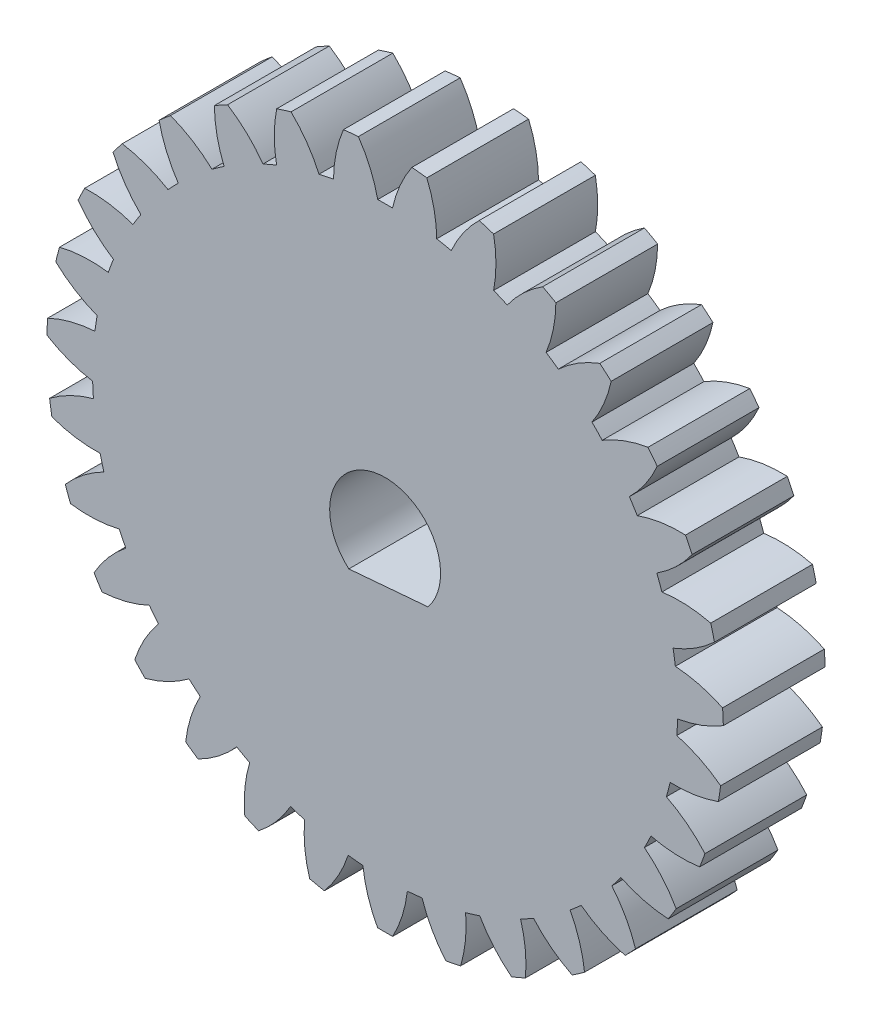
from build123d import *

# Parameters (mm, degrees)
BOSS_EXTRUDE1_DEPTH = 5


with BuildPart() as part:
    # Model → Boss-Extrude1 (new body)
    with BuildSketch(Plane.XY):
        with BuildLine():
            ThreePointArc((14.369367897, -0.364886625), (15.533878417, -0.05414421), (16.618302644, 0.4718498))
            ThreePointArc((16.618302644, 0.4718498), (16.603661932, 0.842042432), (16.58077576, 1.211816902))
            ThreePointArc((16.58077576, 1.211816902), (15.448701432, 1.625402827), (14.25872835, 1.816739348))
            ThreePointArc((14.25872835, 1.816739348), (14.208243694, 2.176622874), (14.148677229, 2.535115118))
            ThreePointArc((14.148677229, 2.535115118), (15.226798163, 3.073910862), (16.183142346, 3.807430735))
            ThreePointArc((16.183142346, 3.807430735), (16.094282101, 4.167098349), (15.997429357, 4.524696561))
            ThreePointArc((15.997429357, 4.524696561), (14.805274422, 4.701931471), (13.6011444, 4.649811502))
            ThreePointArc((13.6011444, 4.649811502), (13.479249148, 4.992165704), (13.348738054, 5.33132895))
            ThreePointArc((13.348738054, 5.33132895), (14.296331003, 6.076119662), (15.085442299, 6.987135009))
            ThreePointArc((15.085442299, 6.987135009), (14.92600047, 7.32155277), (14.759146317, 7.652334612))
            ThreePointArc((14.759146317, 7.652334612), (13.555717739, 7.585962488), (12.386728002, 7.292519826))
            ThreePointArc((12.386728002, 7.292519826), (12.198412557, 7.603328684), (12.002299974, 7.909277549))
            ThreePointArc((12.002299974, 7.909277549), (12.780570371, 8.829571409), (13.370142472, 9.880785155))
            ThreePointArc((13.370142472, 9.880785155), (13.146646627, 10.17626196), (12.916622092, 10.466685184))
            ThreePointArc((12.916622092, 10.466685184), (11.751188378, 10.15942331), (10.665197503, 9.636671533))
            ThreePointArc((10.665197503, 9.636671533), (10.418171524, 9.903210495), (10.164486323, 10.163419395))
            ThreePointArc((10.164486323, 10.163419395), (10.741571688, 11.221539465), (11.107467442, 12.369914795))
            ThreePointArc((11.107467442, 12.369914795), (10.829067525, 12.61435379), (10.545289841, 12.852528435))
            ThreePointArc((10.545289841, 12.852528435), (9.465563984, 12.316956148), (8.507032565, 11.586296774))
            ThreePointArc((8.507032565, 11.586296774), (8.211409324, 11.797653704), (7.910537407, 12.001469657))
            ThreePointArc((7.910537407, 12.001469657), (8.262811797, 13.154096377), (8.390051389, 14.35261867))
            ThreePointArc((8.390051389, 14.35261867), (8.068145127, 14.536012493), (7.742232185, 14.712187662))
            ThreePointArc((7.742232185, 14.712187662), (6.792418289, 13.970231354), (6.000588715, 13.061577664))
            ThreePointArc((6.000588715, 13.061577664), (5.668471061, 13.209099584), (5.332730161, 13.348178341))
            ThreePointArc((5.332730161, 13.348178341), (5.44577142, 14.548123038), (5.329145646, 15.747724651))
            ThreePointArc((5.329145646, 15.747724651), (4.97691192, 15.862565138), (4.622206634, 15.969528197))
            ThreePointArc((4.622206634, 15.969528197), (3.84119019, 15.051563646), (3.248480058, 14.00211603))
            ThreePointArc((3.248480058, 14.00211603), (2.893464928, 14.079763376), (2.536600316, 14.148411036))
            ThreePointArc((2.536600316, 14.148411036), (2.405780521, 15.346547832), (2.050064055, 16.498116934))
            ThreePointArc((2.050064055, 16.498116934), (1.681923353, 16.539702501), (1.3129474, 16.573074372))
            ThreePointArc((1.3129474, 16.573074372), (0.732703314, 15.516683155), (0.363378245, 14.36940612))
            ThreePointArc((0.363378245, 14.36940612), (0, 14.374), (-0.363378245, 14.36940612))
            ThreePointArc((-0.363378245, 14.36940612), (-0.732703314, 15.516683155), (-1.3129474, 16.573074372))
            ThreePointArc((-1.3129474, 16.573074372), (-1.681923353, 16.539702501), (-2.050064055, 16.498116934))
            ThreePointArc((-2.050064055, 16.498116934), (-2.405780521, 15.346547832), (-2.536600315, 14.148411036))
            ThreePointArc((-2.536600315, 14.148411036), (-2.893464928, 14.079763376), (-3.248480058, 14.00211603))
            ThreePointArc((-3.248480058, 14.00211603), (-3.84119019, 15.051563647), (-4.622206634, 15.969528197))
            ThreePointArc((-4.622206634, 15.969528197), (-4.976911919, 15.862565138), (-5.329145646, 15.747724651))
            ThreePointArc((-5.329145646, 15.747724651), (-5.44577142, 14.548123037), (-5.33273016, 13.34817834))
            ThreePointArc((-5.33273016, 13.34817834), (-5.668471061, 13.209099583), (-6.000588714, 13.061577663))
            ThreePointArc((-6.000588714, 13.061577663), (-6.792418288, 13.970231353), (-7.742232185, 14.71218766))
            ThreePointArc((-7.742232185, 14.71218766), (-8.068145126, 14.536012492), (-8.390051388, 14.352618669))
            ThreePointArc((-8.390051388, 14.352618669), (-8.262811796, 13.154096376), (-7.910537407, 12.001469656))
            ThreePointArc((-7.910537407, 12.001469656), (-8.211409323, 11.797653703), (-8.507032564, 11.586296773))
            ThreePointArc((-8.507032564, 11.586296773), (-9.465563983, 12.316956147), (-10.54528984, 12.852528434))
            ThreePointArc((-10.54528984, 12.852528434), (-10.829067524, 12.614353789), (-11.107467441, 12.369914794))
            ThreePointArc((-11.107467441, 12.369914794), (-10.741571687, 11.221539464), (-10.164486322, 10.163419394))
            ThreePointArc((-10.164486322, 10.163419394), (-10.418171523, 9.903210494), (-10.665197502, 9.636671532))
            ThreePointArc((-10.665197502, 9.636671532), (-11.751188377, 10.159423309), (-12.916622091, 10.466685183))
            ThreePointArc((-12.916622091, 10.466685183), (-13.146646626, 10.176261959), (-13.370142471, 9.880785154))
            ThreePointArc((-13.370142471, 9.880785154), (-12.78057037, 8.829571408), (-12.002299973, 7.909277548))
            ThreePointArc((-12.002299973, 7.909277548), (-12.198412556, 7.603328684), (-12.386728, 7.292519826))
            ThreePointArc((-12.386728, 7.292519826), (-13.555717737, 7.585962488), (-14.759146315, 7.652334611))
            ThreePointArc((-14.759146315, 7.652334611), (-14.926000469, 7.321552769), (-15.085442298, 6.987135008))
            ThreePointArc((-15.085442298, 6.987135008), (-14.296331002, 6.076119661), (-13.348738053, 5.33132895))
            ThreePointArc((-13.348738053, 5.33132895), (-13.479249146, 4.992165704), (-13.601144399, 4.649811501))
            ThreePointArc((-13.601144399, 4.649811501), (-14.805274421, 4.701931471), (-15.997429356, 4.524696561))
            ThreePointArc((-15.997429356, 4.524696561), (-16.0942821, 4.167098349), (-16.183142345, 3.807430735))
            ThreePointArc((-16.183142345, 3.807430735), (-15.226798162, 3.073910862), (-14.148677228, 2.535115118))
            ThreePointArc((-14.148677228, 2.535115118), (-14.208243693, 2.176622874), (-14.258728348, 1.816739348))
            ThreePointArc((-14.258728348, 1.816739348), (-15.448701431, 1.625402827), (-16.580775759, 1.211816902))
            ThreePointArc((-16.580775759, 1.211816902), (-16.603661931, 0.842042432), (-16.618302643, 0.4718498))
            ThreePointArc((-16.618302643, 0.4718498), (-15.533878417, -0.05414421), (-14.369367896, -0.364886625))
            ThreePointArc((-14.369367896, -0.364886625), (-14.355551073, -0.728031153), (-14.332558284, -1.090710328))
            ThreePointArc((-14.332558284, -1.090710328), (-15.459656789, -1.51767), (-16.485303254, -2.150674683))
            ThreePointArc((-16.485303254, -2.150674683), (-16.433285891, -2.517486801), (-16.373107678, -2.883048722))
            ThreePointArc((-16.373107678, -2.883048722), (-15.204999864, -3.179982611), (-14.001774953, -3.249949866))
            ThreePointArc((-14.001774953, -3.249949866), (-13.915140506, -3.602879499), (-13.819611599, -3.953506196))
            ThreePointArc((-13.819611599, -3.953506196), (-14.837691981, -4.598609238), (-15.714920497, -5.425117395))
            ThreePointArc((-15.714920497, -5.425117395), (-15.590129196, -5.773949828), (-15.457595761, -6.11991489))
            ThreePointArc((-15.457595761, -6.11991489), (-14.25362683, -6.175632151), (-13.060947699, -6.001959778))
            ThreePointArc((-13.060947699, -6.001959778), (-12.905042451, -6.330225534), (-12.740888391, -6.654445055))
            ThreePointArc((-12.740888391, -6.654445055), (-13.608270321, -7.491280875), (-14.301167049, -8.477455162))
            ThreePointArc((-14.301167049, -8.477455162), (-14.10871078, -8.794026671), (-13.909248058, -9.106231024))
            ThreePointArc((-13.909248058, -9.106231024), (-12.718708639, -8.918450585), (-11.585403712, -8.508248752))
            ThreePointArc((-11.585403712, -8.508248752), (-11.366610442, -8.798411393), (-11.140551716, -9.082950151))
            ThreePointArc((-11.140551716, -9.082950151), (-11.821724474, -10.077258592), (-12.301922141, -11.18272492))
            ThreePointArc((-12.301922141, -11.18272492), (-12.049680087, -11.454075029), (-11.791454104, -11.71973699))
            ThreePointArc((-11.791454104, -11.71973699), (-10.663085021, -11.296146604), (-9.635551935, -10.666209022))
            ThreePointArc((-9.635551935, -10.666209022), (-9.362828066, -10.906389255), (-9.084119544, -11.139598202))
            ThreePointArc((-9.084119544, -11.139598202), (-9.551195839, -12.250672158), (-9.799035095, -13.430172605))
            ThreePointArc((-9.799035095, -13.430172605), (-9.497334076, -13.64519221), (-9.190916634, -13.853435546))
            ThreePointArc((-9.190916634, -13.853435546), (-8.170913451, -13.211377054), (-7.29121953, -12.387493442))
            ThreePointArc((-7.29121953, -12.387493442), (-6.975730409, -12.56785826), (-6.655782451, -12.740189793))
            ThreePointArc((-6.655782451, -12.740189793), (-6.889640123, -13.922541767), (-6.894974401, -15.127787446))
            ThreePointArc((-6.894974401, -15.127787446), (-6.556166091, -15.277673618), (-6.214101957, -15.419972823))
            ThreePointArc((-6.214101957, -15.419972823), (-5.344223723, -14.585732175), (-4.64838374, -13.601632424))
            ThreePointArc((-4.64838374, -13.601632424), (-4.30304553, -13.714797671), (-3.954956843, -13.819196517))
            ThreePointArc((-3.954956843, -13.819196517), (-3.946021732, -15.02442088), (-3.708632645, -16.206068891))
            ThreePointArc((-3.708632645, -16.206068891), (-3.346587896, -16.284685273), (-2.982881216, -16.355214601))
            ThreePointArc((-2.982881216, -16.355214601), (-2.298740848, -15.362945707), (-1.815242574, -14.258918977))
            ThreePointArc((-1.815242574, -14.258918977), (-1.45419346, -14.300251654), (-1.092214836, -14.332443712))
            ThreePointArc((-1.092214836, -14.332443712), (-0.840852747, -15.511198437), (-0.370459033, -16.620871972))
            ThreePointArc((-0.370459033, -16.620871972), (0, -16.625), (0.370459033, -16.620871972))
            ThreePointArc((0.370459033, -16.620871972), (0.840852747, -15.511198437), (1.092214836, -14.332443712))
            ThreePointArc((1.092214836, -14.332443712), (1.45419346, -14.300251654), (1.815242574, -14.258918977))
            ThreePointArc((1.815242574, -14.258918977), (2.298740848, -15.362945707), (2.982881216, -16.355214601))
            ThreePointArc((2.982881216, -16.355214601), (3.346587897, -16.284685273), (3.708632645, -16.206068891))
            ThreePointArc((3.708632645, -16.206068891), (3.946021732, -15.02442088), (3.954956843, -13.819196517))
            ThreePointArc((3.954956843, -13.819196517), (4.30304553, -13.714797671), (4.64838374, -13.601632424))
            ThreePointArc((4.64838374, -13.601632424), (5.344223723, -14.585732175), (6.214101957, -15.419972823))
            ThreePointArc((6.214101957, -15.419972823), (6.556166091, -15.277673618), (6.894974401, -15.127787446))
            ThreePointArc((6.894974401, -15.127787446), (6.889640124, -13.922541767), (6.655782452, -12.740189793))
            ThreePointArc((6.655782452, -12.740189793), (6.975730409, -12.56785826), (7.29121953, -12.387493442))
            ThreePointArc((7.29121953, -12.387493442), (8.170913451, -13.211377054), (9.190916634, -13.853435546))
            ThreePointArc((9.190916634, -13.853435546), (9.497334076, -13.64519221), (9.799035095, -13.430172605))
            ThreePointArc((9.799035095, -13.430172605), (9.551195839, -12.250672158), (9.084119545, -11.139598202))
            ThreePointArc((9.084119545, -11.139598202), (9.362828067, -10.906389256), (9.635551935, -10.666209022))
            ThreePointArc((9.635551935, -10.666209022), (10.663085022, -11.296146604), (11.791454104, -11.71973699))
            ThreePointArc((11.791454104, -11.71973699), (12.049680088, -11.45407503), (12.301922141, -11.18272492))
            ThreePointArc((12.301922141, -11.18272492), (11.821724475, -10.077258592), (11.140551716, -9.082950152))
            ThreePointArc((11.140551716, -9.082950152), (11.366610443, -8.798411393), (11.585403712, -8.508248752))
            ThreePointArc((11.585403712, -8.508248752), (12.718708639, -8.918450585), (13.909248058, -9.106231024))
            ThreePointArc((13.909248058, -9.106231024), (14.108710781, -8.794026672), (14.301167049, -8.477455163))
            ThreePointArc((14.301167049, -8.477455163), (13.608270321, -7.491280875), (12.740888392, -6.654445055))
            ThreePointArc((12.740888392, -6.654445055), (12.905042452, -6.330225534), (13.0609477, -6.001959779))
            ThreePointArc((13.0609477, -6.001959779), (14.25362683, -6.175632151), (15.457595762, -6.119914891))
            ThreePointArc((15.457595762, -6.119914891), (15.590129197, -5.773949829), (15.714920498, -5.425117395))
            ThreePointArc((15.714920498, -5.425117395), (14.837691982, -4.598609239), (13.8196116, -3.953506196))
            ThreePointArc((13.8196116, -3.953506196), (13.915140507, -3.602879499), (14.001774954, -3.249949866))
            ThreePointArc((14.001774954, -3.249949866), (15.204999864, -3.179982612), (16.373107679, -2.883048722))
            ThreePointArc((16.373107679, -2.883048722), (16.433285892, -2.517486801), (16.485303255, -2.150674684))
            ThreePointArc((16.485303255, -2.150674684), (15.45965679, -1.51767), (14.332558285, -1.090710329))
            ThreePointArc((14.332558285, -1.090710329), (14.355551074, -0.728031153), (14.369367897, -0.364886625))
        make_face()
        with BuildLine():
            Line((-1.783975901, -2.059867711), (2.104867485, -1.730652441))
            ThreePointArc((2.104867485, -1.730652441), (-0.229866321, 2.715287547), (-1.783975901, -2.059867711))
        make_face(mode=Mode.SUBTRACT)
    extrude(amount=BOSS_EXTRUDE1_DEPTH)


solid = part.part
